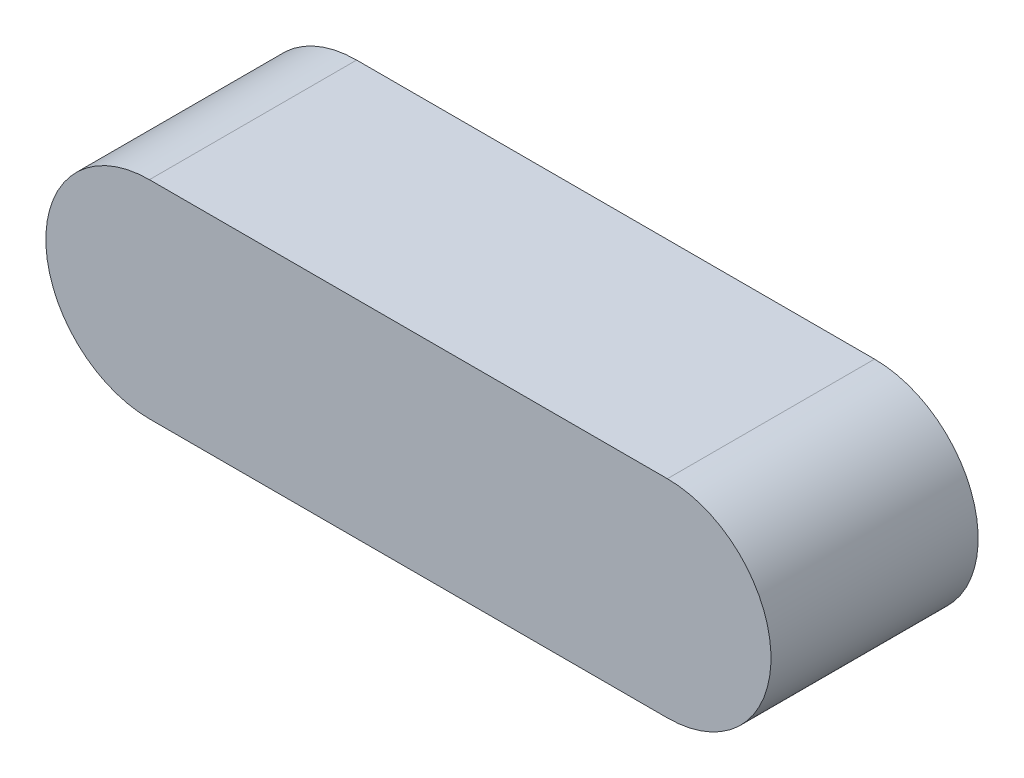
from build123d import *

# Parameters (mm, degrees)
EXTRUDE_1_DEPTH = 4


with BuildPart() as part:
    # ｽｹｯﾁ1 → ﾎﾞｽ - 押し出し1 (new body)
    with BuildSketch(Plane.XY):
        with BuildLine():
            Line((0, 2), (10, 2))
            ThreePointArc((10, 2), (12, 0), (10, -2))
            Line((10, -2), (0, -2))
            ThreePointArc((0, -2), (-2, 0), (0, 2))
        make_face()
    extrude(amount=EXTRUDE_1_DEPTH)


solid = part.part
